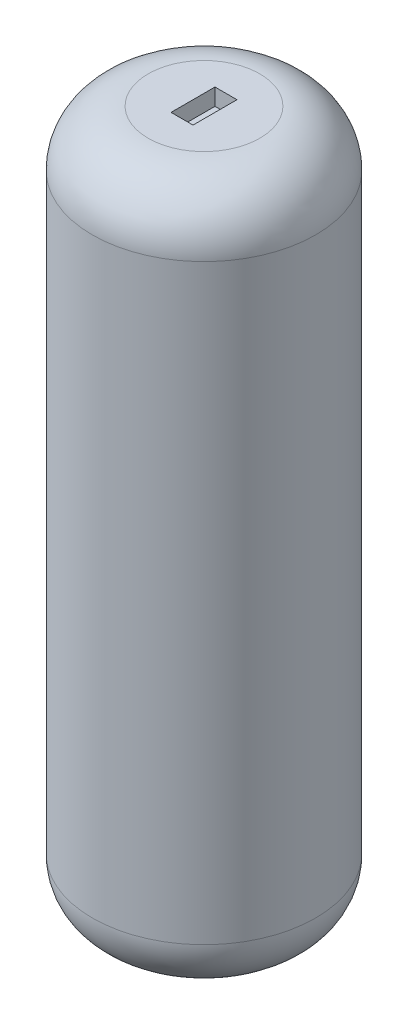
from build123d import *

# Parameters (mm, degrees)
SKETCH1_R          = 50.8
EXTRUDE1_DEPTH     = 320
FILLET1_R          = 25.4
SKETCH3_W          = 10
SKETCH3_H          = 20
CUT_EXTRUDE1_DEPTH = 7.62
SKETCH4_R          = 19.05
CUT_EXTRUDE2_DEPTH = 2.54


with BuildPart() as part:
    # Sketch1 → Extrude1 (new body)
    with BuildSketch(Plane(origin=(0, 0, 0), x_dir=(1, 0, 0), z_dir=(0, 1, 0))):
        with Locations(Location((0, 0, 0), (0, 0, 270))):
            Circle(SKETCH1_R)
    extrude(amount=EXTRUDE1_DEPTH)

    # Fillet1
    fillet1_edges = [part.edges().sort_by_distance(p)[0] for p in [
        (0, 0, -50.8),
        (0, 320, -50.8),
    ]]
    fillet(fillet1_edges, radius=FILLET1_R)

    # Sketch3 → Cut-Extrude1 (cut)
    with BuildSketch(Plane(origin=(0, 320, 0), x_dir=(1, 0, 0), z_dir=(0, 1, 0))):
        Rectangle(SKETCH3_W, SKETCH3_H)
    extrude(amount=-CUT_EXTRUDE1_DEPTH, mode=Mode.SUBTRACT)

    # Sketch4 → Cut-Extrude2 (cut)
    with BuildSketch(Plane.XZ):
        with Locations(Location((0, 0, 0), (0, 0, 270))):
            Circle(SKETCH4_R)
    extrude(amount=-CUT_EXTRUDE2_DEPTH, mode=Mode.SUBTRACT)


solid = part.part
